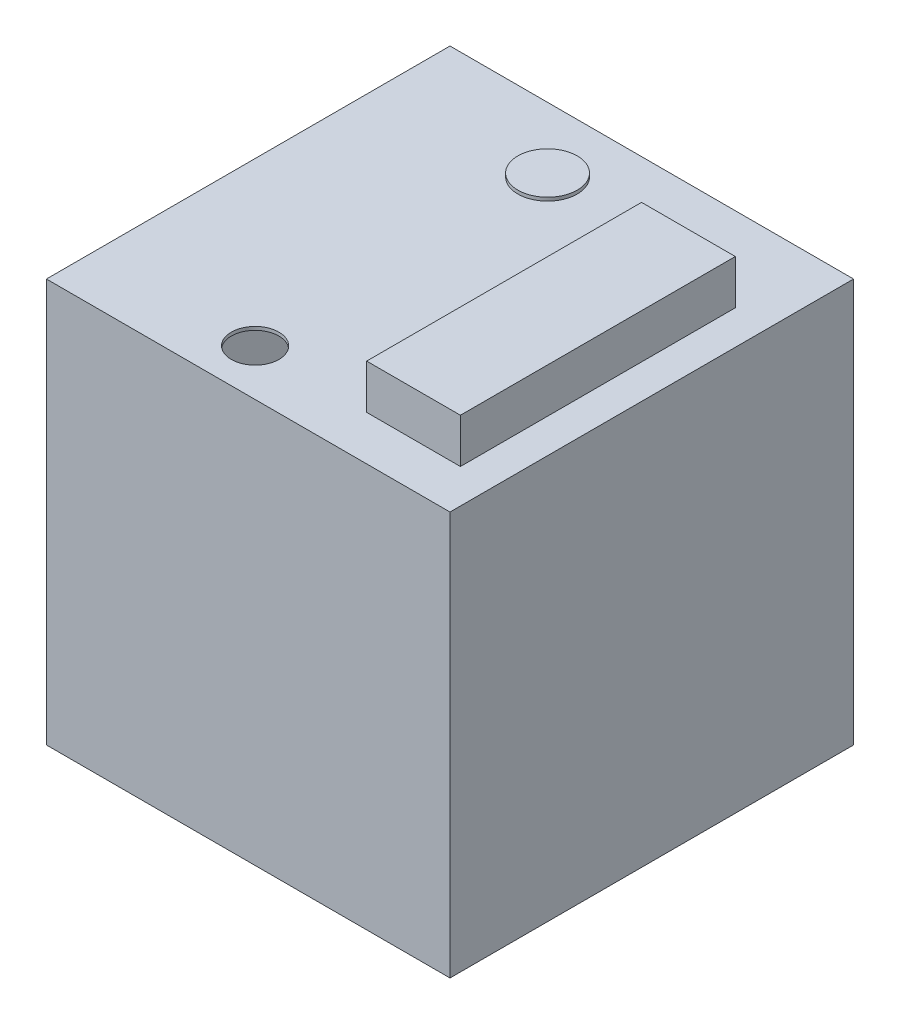
from build123d import *

# Parameters (mm, degrees)
SKETCH1_W           = 300
SKETCH1_H           = 300
BOSS_EXTRUDE1_DEPTH = 300
SHELL1_T            = -2.54
SKETCH2_W           = 300
SKETCH2_H           = 300
BOSS_EXTRUDE2_DEPTH = 2.54
SKETCH3_R           = 15.897271206
SKETCH3_R_2         = 16.201962057
SKETCH3_R_3         = 17.191821314
SKETCH3_R_4         = 17.661116969
CUT_EXTRUDE1_DEPTH  = 2.54
SKETCH4_R           = 22.06299853
SKETCH4_R_2         = 19.946075444
BOSS_EXTRUDE3_DEPTH = 2.54
SKETCH5_R           = 19.013382907
CUT_EXTRUDE2_DEPTH  = 2.54
SKETCH6_W           = 69.704124702
SKETCH6_H           = 204.3475123
SKETCH6_W_2         = 60.465312628
SKETCH6_H_2         = 192.466149128
BOSS_EXTRUDE4_DEPTH = 30.48
SKETCH7_W           = 69.704124702
SKETCH7_H           = 204.3475123
BOSS_EXTRUDE5_DEPTH = 2.54


with BuildPart() as part:
    # Sketch1 → Boss-Extrude1 (new body)
    with BuildSketch(Plane(origin=(0, 0, 0), x_dir=(1, 0, 0), z_dir=(0, 1, 0))):
        with Locations((150, 150)):
            Rectangle(SKETCH1_W, SKETCH1_H)
    extrude(amount=BOSS_EXTRUDE1_DEPTH)

    # Shell1
    shell1_openings = [part.faces().sort_by_distance(p)[0] for p in [
        (150, 300, -150),
    ]]
    offset(amount=SHELL1_T, openings=shell1_openings, kind=Kind.INTERSECTION)

    # Sketch2 → Boss-Extrude2 (add)
    with BuildSketch(Plane(origin=(0, 300, 0), x_dir=(1, 0, 0), z_dir=(0, 1, 0))):
        with Locations((150, 150)):
            Rectangle(SKETCH2_W, SKETCH2_H)
    extrude(amount=-BOSS_EXTRUDE2_DEPTH)

    # Sketch3 → Cut-Extrude1 (cut)
    with BuildSketch(Plane(origin=(0, 300, 0), x_dir=(1, 0, 0), z_dir=(0, 1, 0))):
        with Locations(Location((241.55793996, 57.94356866, 0), (0, 0, 270))):
            Circle(SKETCH3_R)
        with Locations(Location((241.55793996, 206.697112563, 0), (0, 0, 270))):
            Circle(SKETCH3_R_2)
        with Locations(Location((120.554438902, 251.95787292, 0), (0, 0, 270))):
            Circle(SKETCH3_R_3)
        with Locations(Location((120.554438902, 34.565752922, 0), (0, 0, 270))):
            Circle(SKETCH3_R_4)
    extrude(amount=-CUT_EXTRUDE1_DEPTH, mode=Mode.SUBTRACT)

    # Sketch4 → Boss-Extrude3 (add)
    with BuildSketch(Plane(origin=(0, 300, 0), x_dir=(1, 0, 0), z_dir=(0, 1, 0))):
        with Locations(Location((120.554438902, 251.95787292, 0), (0, 0, 90))):
            Circle(SKETCH4_R)
        with Locations(Location((241.55793996, 206.697112563, 0), (0, 0, 90))):
            Circle(SKETCH4_R_2)
    extrude(amount=BOSS_EXTRUDE3_DEPTH)

    # Sketch5 → Cut-Extrude2 (cut)
    with BuildSketch(Plane(origin=(0, 300, 0), x_dir=(1, 0, 0), z_dir=(0, 1, 0))):
        with Locations(Location((241.852973127, 150.869372117, 0), (0, 0, 270))):
            Circle(SKETCH5_R)
    extrude(amount=-CUT_EXTRUDE2_DEPTH, mode=Mode.SUBTRACT)

    # Sketch6 → Boss-Extrude4 (add)
    with BuildSketch(Plane(origin=(0, 300, 0), x_dir=(1, 0, 0), z_dir=(0, 1, 0))):
        with Locations((239.736552446, 135.332520717)):
            Rectangle(SKETCH6_W, SKETCH6_H)
        with Locations((239.510491416, 134.641215144)):
            Rectangle(SKETCH6_W_2, SKETCH6_H_2, mode=Mode.SUBTRACT)
    extrude(amount=BOSS_EXTRUDE4_DEPTH)

    # Sketch7 → Boss-Extrude5 (add)
    with BuildSketch(Plane(origin=(0, 330.48, 0), x_dir=(1, 0, 0), z_dir=(0, 1, 0))):
        with Locations((239.736552446, 135.332520717)):
            Rectangle(SKETCH7_W, SKETCH7_H)
    extrude(amount=BOSS_EXTRUDE5_DEPTH)


solid = part.part
